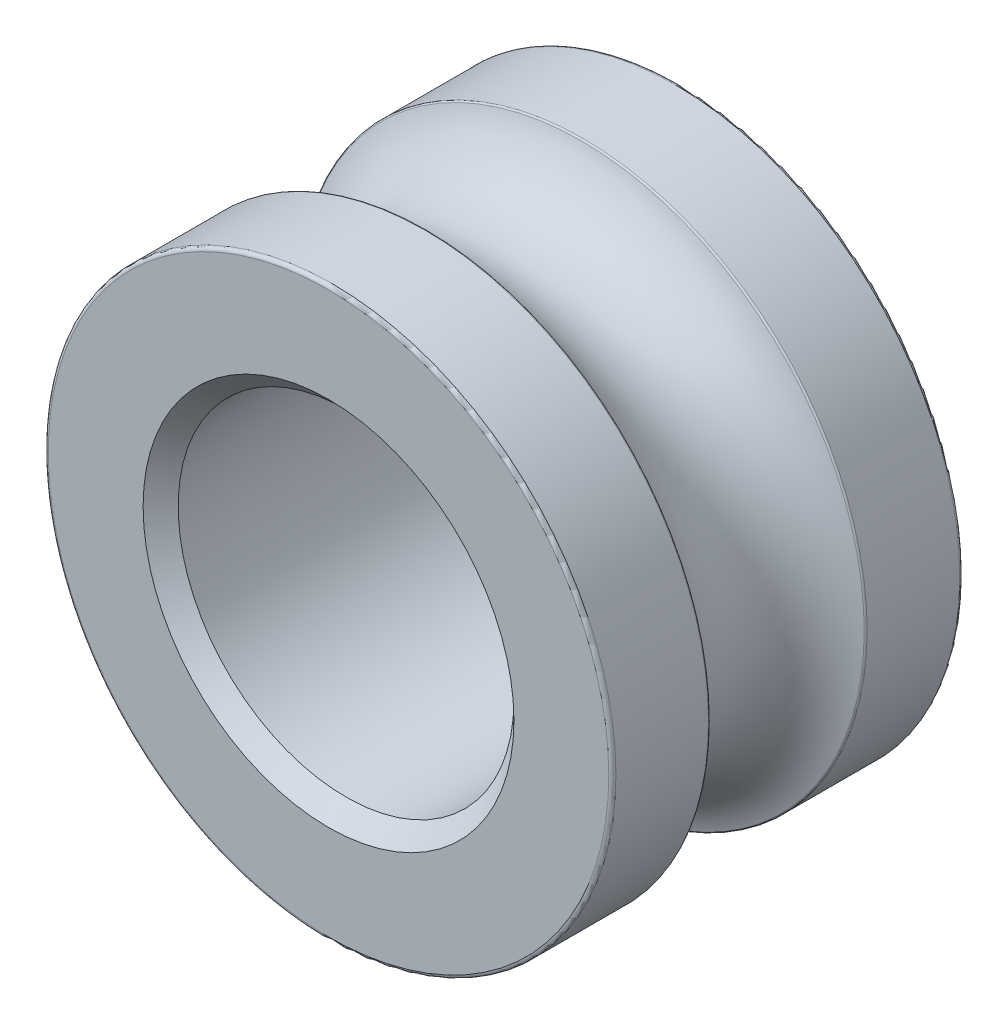
from build123d import *


with BuildPart() as part:
    # Inner Bearing Race Profile → Inner Bearing Race (revolve)
    with BuildSketch(Plane(origin=(0, 0, 0), x_dir=(0, 0, -1), z_dir=(1, 0, 0))):
        with BuildLine():
            Line((2.24028, 2.38125), (2.4892, 2.63017))
            Line((2.4892, 2.63017), (2.4892, 3.975414011))
            ThreePointArc((2.4892, 3.975414011), (2.474321024, 4.011335035), (2.4384, 4.026214011))
            Line((2.4384, 4.026214011), (1.12493032, 4.026214011))
            ThreePointArc((1.12493032, 4.026214011), (1.109994783, 4.021358833), (1.100769063, 4.008649422))
            ThreePointArc((1.100769063, 4.008649422), (0, 3.208419705), (-1.100769063, 4.008649422))
            ThreePointArc((-1.100769063, 4.008649422), (-1.109994783, 4.021358833), (-1.12493032, 4.026214011))
            Line((-1.12493032, 4.026214011), (-2.4384, 4.026214011))
            ThreePointArc((-2.4384, 4.026214011), (-2.474321024, 4.011335035), (-2.4892, 3.975414011))
            Line((-2.4892, 3.975414011), (-2.4892, 2.63017))
            Line((-2.4892, 2.63017), (-2.24028, 2.38125))
            Line((-2.24028, 2.38125), (2.24028, 2.38125))
        make_face()
    revolve(axis=Axis((0, 0, 2.4892), (0, 0, -1)))


solid = part.part
